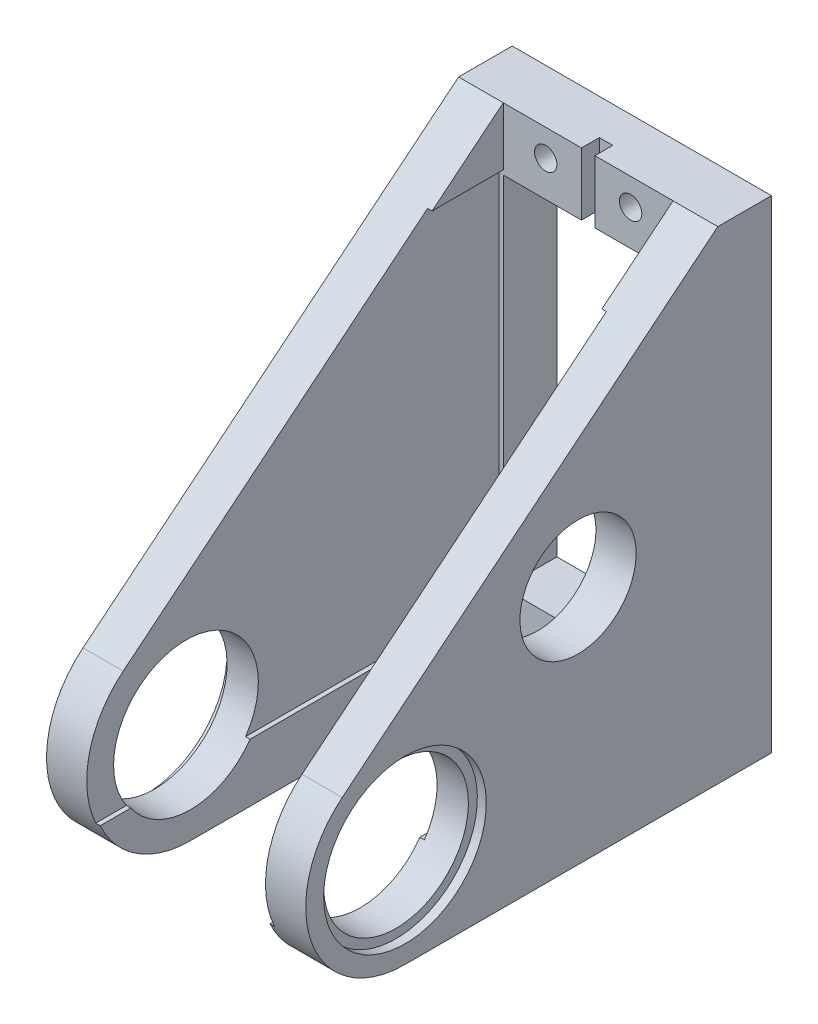
from build123d import *

# Parameters (mm, degrees)
SKETCH_1_W          = 29
SKETCH_1_H          = 54
SKETCH_1_R          = 1.25
SKETCH_1_W_2        = 19
SKETCH_1_H_2        = 40
EXTRUDE_1_DEPTH     = 6
SKETCH_2_W          = 1.5
SKETCH_2_H          = 7
CUT_EXTRUDE_1_DEPTH = 2
SKETCH_3_R          = 8.1
EXTRUDE_2_DEPTH     = 5
SKETCH_4_R          = 9.1
CUT_EXTRUDE_2_DEPTH = 1
SKETCH_5_W          = 20
SKETCH_5_H          = 41
CUT_EXTRUDE_3_DEPTH = 71.072890621
SKETCH_6_R          = 6.5
CUT_EXTRUDE_4_DEPTH = 5


with BuildPart() as part:
    # Эскиз1 → Бобышка-Вытянуть1 (new body)
    with BuildSketch(Plane.XY):
        with Locations((9.5, -20)):
            Rectangle(SKETCH_1_W, SKETCH_1_H)
        with Locations((4.75, 4)):
            Circle(SKETCH_1_R, mode=Mode.SUBTRACT)
        with Locations((14.25, 4)):
            Circle(SKETCH_1_R, mode=Mode.SUBTRACT)
        with Locations((4.75, -44)):
            Circle(SKETCH_1_R, mode=Mode.SUBTRACT)
        with Locations((14.25, -44)):
            Circle(SKETCH_1_R, mode=Mode.SUBTRACT)
        with Locations((9.5, -20)):
            Rectangle(SKETCH_1_W_2, SKETCH_1_H_2, mode=Mode.SUBTRACT)
    extrude(amount=EXTRUDE_1_DEPTH)

    # Эскиз2 → Вырез-Вытянуть1 (cut)
    with BuildSketch(Plane.XY.offset(6)):
        with Locations((9.5, -43.5)):
            Rectangle(SKETCH_2_W, SKETCH_2_H)
        with Locations((9.5, 3.5)):
            Rectangle(SKETCH_2_W, SKETCH_2_H)
    extrude(amount=-CUT_EXTRUDE_1_DEPTH, mode=Mode.SUBTRACT)

    # Эскиз3 → Бобышка-Вытянуть2 (add)
    with BuildSketch(Plane(origin=(24, 0, 0), x_dir=(0, 0, -1), z_dir=(1, 0, 0))):
        with BuildLine():
            Line((-6, -47), (-41, -47))
            ThreePointArc((-41, -47), (-51.456010485, -39.625834772), (-48.019345484, -27.301233288))
            Line((-48.019345484, -27.301233288), (-6, 7))
            Line((-6, 7), (-6, -47))
        make_face()
        with Locations(Location((-41, -35.9, 0), (0, 0, 90))):
            Circle(SKETCH_3_R, mode=Mode.SUBTRACT)
    extrude_2 = extrude(amount=-EXTRUDE_2_DEPTH)

    # Эскиз4 → Вырез-Вытянуть2 (cut)
    with BuildSketch(Plane(origin=(24, 0, 0), x_dir=(0, 0, -1), z_dir=(1, 0, 0))):
        with Locations(Location((-41, -35.9, 0), (0, 0, 90))):
            Circle(SKETCH_4_R)
    cut_extrude_2 = extrude(amount=-CUT_EXTRUDE_2_DEPTH, mode=Mode.SUBTRACT)

    # Зеркальное отражение1: Бобышка-Вытянуть2, Вырез-Вытянуть2 across plane
    add(extrude_2.mirror(Plane.ZY.offset(-9.5)))
    add(cut_extrude_2.mirror(Plane.ZY.offset(-9.5)), mode=Mode.SUBTRACT)

    # Эскиз5 → Вырез-Вытянуть3 (cut, through all)
    with BuildSketch(Plane.XY.offset(6)):
        with Locations((9.5, -20)):
            Rectangle(SKETCH_5_W, SKETCH_5_H)
    extrude(amount=CUT_EXTRUDE_3_DEPTH, mode=Mode.SUBTRACT)

    # Эскиз6 → Вырез-Вытянуть4 (cut)
    with BuildSketch(Plane(origin=(24, 0, 0), x_dir=(0, 0, -1), z_dir=(1, 0, 0))):
        with Locations(Location((-21.633408306, -20.090663323, 0), (0, 0, 90))):
            Circle(SKETCH_6_R)
    extrude(amount=-CUT_EXTRUDE_4_DEPTH, mode=Mode.SUBTRACT)


solid = part.part
